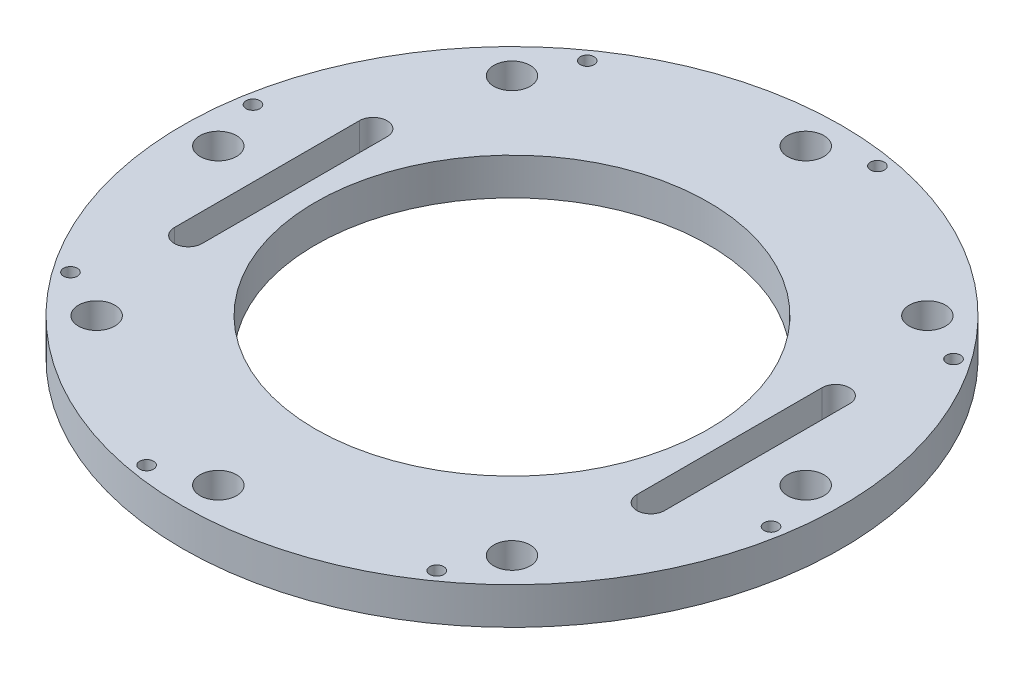
from build123d import *

# Parameters (mm, degrees)
SKETCH1_R           = 14.25
SKETCH1_R_2         = 0.3
SKETCH1_R_3         = 0.7874
SKETCH1_R_4         = 8.5
BOSS_EXTRUDE1_DEPTH = 1.6


with BuildPart() as part:
    # Sketch1 → Boss-Extrude1 (new body)
    with BuildSketch(Plane(origin=(0, 0, 0), x_dir=(1, 0, 0), z_dir=(0, 1, 0))):
        Circle(SKETCH1_R)
        with Locations((-11.172287143, -7.919595949)):
            Circle(SKETCH1_R_2, mode=Mode.SUBTRACT)
        with Locations((-8.980256121, -8.980256121)):
            Circle(SKETCH1_R_3, mode=Mode.SUBTRACT)
        with Locations((-2.3, -13.5)):
            Circle(SKETCH1_R_2, mode=Mode.SUBTRACT)
        with Locations((0, -12.7)):
            Circle(SKETCH1_R_3, mode=Mode.SUBTRACT)
        with Locations((7.919595949, -11.172287143)):
            Circle(SKETCH1_R_2, mode=Mode.SUBTRACT)
        with Locations((8.980256121, -8.980256121)):
            Circle(SKETCH1_R_3, mode=Mode.SUBTRACT)
        with Locations((13.5, -2.3)):
            Circle(SKETCH1_R_2, mode=Mode.SUBTRACT)
        with Locations((12.7, 0)):
            Circle(SKETCH1_R_3, mode=Mode.SUBTRACT)
        with Locations((-12.7, 0)):
            Circle(SKETCH1_R_3, mode=Mode.SUBTRACT)
        with Locations((-13.5, 2.3)):
            Circle(SKETCH1_R_2, mode=Mode.SUBTRACT)
        with BuildLine():
            Line((-9.4, 4), (-9.4, -4))
            ThreePointArc((-9.4, -4), (-10, -4.6), (-10.6, -4))
            Line((-10.6, -4), (-10.6, 4))
            ThreePointArc((-10.6, 4), (-10, 4.6), (-9.4, 4))
        make_face(mode=Mode.SUBTRACT)
        with Locations((-8.980256121, 8.980256121)):
            Circle(SKETCH1_R_3, mode=Mode.SUBTRACT)
        with Locations((-7.919595949, 11.172287143)):
            Circle(SKETCH1_R_2, mode=Mode.SUBTRACT)
        Circle(SKETCH1_R_4, mode=Mode.SUBTRACT)
        with BuildLine():
            ThreePointArc((10.6, -4), (10, -4.6), (9.4, -4))
            Line((9.4, -4), (9.4, 4))
            ThreePointArc((9.4, 4), (10, 4.6), (10.6, 4))
            Line((10.6, 4), (10.6, -4))
        make_face(mode=Mode.SUBTRACT)
        with Locations((0, 12.7)):
            Circle(SKETCH1_R_3, mode=Mode.SUBTRACT)
        with Locations((2.3, 13.5)):
            Circle(SKETCH1_R_2, mode=Mode.SUBTRACT)
        with Locations((8.980256121, 8.980256121)):
            Circle(SKETCH1_R_3, mode=Mode.SUBTRACT)
        with Locations((11.172287143, 7.919595949)):
            Circle(SKETCH1_R_2, mode=Mode.SUBTRACT)
    extrude(amount=BOSS_EXTRUDE1_DEPTH)


solid = part.part
